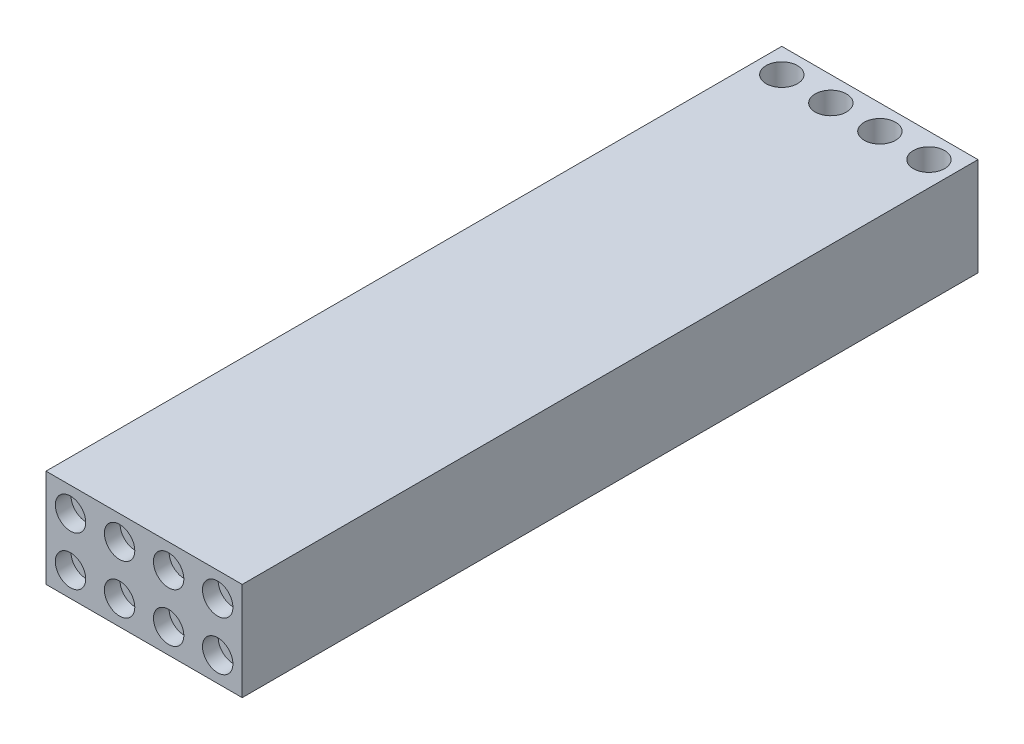
from build123d import *

# Parameters (mm, degrees)
SKETCH_1_W               = 20
SKETCH_1_H               = 20
EXTRUDE_1_DEPTH          = 150
SKETCH_3_R               = 3.2
CUT_EXTRUDE_2_DEPTH      = 18
SKETCH_4_R               = 3.1
CUT_EXTRUDE_3_DEPTH      = 3.2
MIRROR_3_COPY_1_SKETCH_R = 3.1
MIRROR_3_COPY_1_DEPTH    = 3.2
MIRROR_4_COPY_1_SKETCH_R = 3.2
MIRROR_4_COPY_1_DEPTH    = 18
MIRROR_4_COPY_2_SKETCH_R = 3.1
MIRROR_4_COPY_2_DEPTH    = 3.2
MIRROR_4_COPY_3_SKETCH_R = 3.1
MIRROR_4_COPY_3_DEPTH    = 3.2
MIRROR_4_COPY_4_SKETCH_R = 3.1
MIRROR_4_COPY_4_DEPTH    = 3.2


with BuildPart() as part:
    # ｽｹｯﾁ1 → ﾎﾞｽ - 押し出し1 (new body)
    with BuildSketch(Plane.XY):
        Rectangle(SKETCH_1_W, SKETCH_1_H)
    extrude_1 = extrude(amount=EXTRUDE_1_DEPTH)

    # ｽｹｯﾁ3 → ｶｯﾄ - 押し出し2 (cut)
    with BuildSketch(Plane(origin=(0, 10, 0), x_dir=(1, 0, 0), z_dir=(0, 1, 0))):
        with Locations(Location((5, -5, 0), (0, 0, 270))):
            Circle(SKETCH_3_R)
    cut_extrude_2 = extrude(amount=-CUT_EXTRUDE_2_DEPTH, mode=Mode.SUBTRACT)

    # ﾐﾗｰ1: ｶｯﾄ - 押し出し2 across plane
    add(cut_extrude_2.mirror(Plane(origin=(0, 0, 0), x_dir=(0, 0, 1), z_dir=(1, 0, 0))), mode=Mode.SUBTRACT)

    # ｽｹｯﾁ4 → ｶｯﾄ - 押し出し3 (cut)
    with BuildSketch(Plane.XY.offset(150)):
        with Locations((5, 5)):
            Circle(SKETCH_4_R)
    cut_extrude_3 = extrude(amount=-CUT_EXTRUDE_3_DEPTH, mode=Mode.SUBTRACT)

    # ﾐﾗｰ2: ｶｯﾄ - 押し出し3 across plane
    add(cut_extrude_3.mirror(Plane.ZX), mode=Mode.SUBTRACT)

    # ﾐﾗｰ3: ｶｯﾄ - 押し出し3 across plane
    add(cut_extrude_3.mirror(Plane(origin=(0, 0, 0), x_dir=(0, 0, 1), z_dir=(1, 0, 0))), mode=Mode.SUBTRACT)

    # ﾐﾗｰ3 copy 1 sketch → ﾐﾗｰ3 copy 1 (cut)
    with BuildSketch(Plane(origin=(0, 0, 150), x_dir=(-1, 0, 0), z_dir=(0, 0, 1))):
        with Locations((5, 5)):
            Circle(MIRROR_3_COPY_1_SKETCH_R)
    extrude(amount=-MIRROR_3_COPY_1_DEPTH, mode=Mode.SUBTRACT)

    # ﾐﾗｰ4: ﾎﾞｽ - 押し出し1, ｶｯﾄ - 押し出し2, ｶｯﾄ - 押し出し3 across plane
    add(extrude_1.mirror(Plane(origin=(-10, 10, 150), x_dir=(0, 0, 1), z_dir=(1, 0, 0))))
    add(cut_extrude_2.mirror(Plane(origin=(-10, 10, 150), x_dir=(0, 0, 1), z_dir=(1, 0, 0))), mode=Mode.SUBTRACT)
    add(cut_extrude_3.mirror(Plane(origin=(-10, 10, 150), x_dir=(0, 0, 1), z_dir=(1, 0, 0))), mode=Mode.SUBTRACT)

    # ﾐﾗｰ4 copy 1 sketch → ﾐﾗｰ4 copy 1 (cut)
    with BuildSketch(Plane(origin=(-20, 10, 0), x_dir=(1, 0, 0), z_dir=(0, 1, 0))):
        with Locations(Location((5, -5, 0), (0, 0, 270))):
            Circle(MIRROR_4_COPY_1_SKETCH_R)
    extrude(amount=-MIRROR_4_COPY_1_DEPTH, mode=Mode.SUBTRACT)

    # ﾐﾗｰ4 copy 2 sketch → ﾐﾗｰ4 copy 2 (cut)
    with BuildSketch(Plane(origin=(-20, 0, 150), x_dir=(-1, 0, 0), z_dir=(0, 0, 1))):
        with Locations((5, 5)):
            Circle(MIRROR_4_COPY_2_SKETCH_R)
    extrude(amount=-MIRROR_4_COPY_2_DEPTH, mode=Mode.SUBTRACT)

    # ﾐﾗｰ4 copy 3 sketch → ﾐﾗｰ4 copy 3 (cut)
    with BuildSketch(Plane(origin=(-20, 0, 150), x_dir=(1, 0, 0), z_dir=(0, 0, 1))):
        with Locations((5, 5)):
            Circle(MIRROR_4_COPY_3_SKETCH_R)
    extrude(amount=-MIRROR_4_COPY_3_DEPTH, mode=Mode.SUBTRACT)

    # ﾐﾗｰ4 copy 4 sketch → ﾐﾗｰ4 copy 4 (cut)
    with BuildSketch(Plane(origin=(-20, 0, 150), x_dir=(1, 0, 0), z_dir=(0, 0, 1))):
        with Locations((5, -5)):
            Circle(MIRROR_4_COPY_4_SKETCH_R)
    extrude(amount=-MIRROR_4_COPY_4_DEPTH, mode=Mode.SUBTRACT)


solid = part.part
